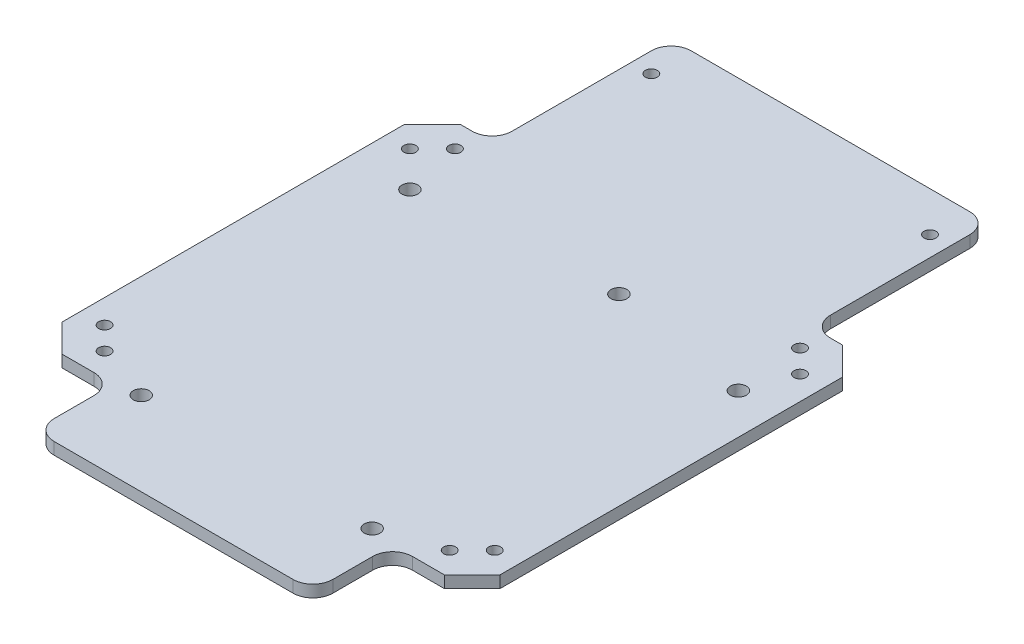
from build123d import *

# Parameters (mm, degrees)
SKETCH_1_R          = 1.5
EXTRUDE_1_DEPTH     = 3
CHAMFER_1_SIZE      = 7
FILLET_1_R          = 5
SKETCH_2_W          = 70
SKETCH_2_H          = 20
EXTRUDE_2_DEPTH     = 3
SKETCH_3_R          = 2
CUT_EXTRUDE_1_DEPTH = 3
FILLET_2_R          = 5


with BuildPart() as part:
    # 草图1 → 凸台-拉伸1 (new body)
    with BuildSketch(Plane(origin=(0, 0, 0), x_dir=(1, 0, 0), z_dir=(0, 1, 0))):
        Polygon((-55, 50), (-55, -50), (55, -50), (55, 50), (40, 50), (40, 95), (-40, 95), (-40, 50), align=None)
        with Locations(Location((-43.343145751, -44, 0), (0, 0, 270))):
            Circle(SKETCH_1_R, mode=Mode.SUBTRACT)
        with Locations(Location((-49, -38.343145751, 0), (0, 0, 270))):
            Circle(SKETCH_1_R, mode=Mode.SUBTRACT)
        with Locations(Location((43.343145751, -44, 0), (0, 0, 270))):
            Circle(SKETCH_1_R, mode=Mode.SUBTRACT)
        with Locations(Location((49, -38.343145751, 0), (0, 0, 270))):
            Circle(SKETCH_1_R, mode=Mode.SUBTRACT)
        with Locations(Location((-49, 38.343145751, 0), (0, 0, 270))):
            Circle(SKETCH_1_R, mode=Mode.SUBTRACT)
        with Locations(Location((-43.343145751, 44, 0), (0, 0, 270))):
            Circle(SKETCH_1_R, mode=Mode.SUBTRACT)
        with Locations(Location((49, 38.343145751, 0), (0, 0, 270))):
            Circle(SKETCH_1_R, mode=Mode.SUBTRACT)
        with Locations(Location((43.343145751, 44, 0), (0, 0, 270))):
            Circle(SKETCH_1_R, mode=Mode.SUBTRACT)
        with Locations(Location((35, 85, 0), (0, 0, 270))):
            Circle(SKETCH_1_R, mode=Mode.SUBTRACT)
        with Locations(Location((-35, 85, 0), (0, 0, 270))):
            Circle(SKETCH_1_R, mode=Mode.SUBTRACT)
    extrude(amount=EXTRUDE_1_DEPTH)

    # 倒角1
    chamfer_1_edges = [part.edges().sort_by_distance(p)[0] for p in [
        (-55, 1.5, 50),
        (-55, 1.5, -50),
        (55, 1.5, -50),
        (55, 1.5, 50),
    ]]
    chamfer(chamfer_1_edges, length=CHAMFER_1_SIZE)

    # 圆角1
    fillet_1_edges = [part.edges().sort_by_distance(p)[0] for p in [
        (-40, 1.5, -50),
        (-40, 1.5, -95),
        (40, 1.5, -95),
        (40, 1.5, -50),
    ]]
    fillet(fillet_1_edges, radius=FILLET_1_R)

    # 草图2 → 凸台-拉伸2 (add)
    with BuildSketch(Plane(origin=(0, 3, 0), x_dir=(1, 0, 0), z_dir=(0, 1, 0))):
        with Locations((0, -60)):
            Rectangle(SKETCH_2_W, SKETCH_2_H)
    extrude(amount=-EXTRUDE_2_DEPTH)

    # 草图3 → 切除-拉伸1 (cut)
    with BuildSketch(Plane(origin=(0, 3, 0), x_dir=(1, 0, 0), z_dir=(0, 1, 0))):
        with Locations(Location((-40.14, 29.5, 0), (0, 0, 270))):
            Circle(SKETCH_3_R)
        with Locations(Location((44.86, 27, 0), (0, 0, 270))):
            Circle(SKETCH_3_R)
        with Locations(Location((-29.14, -49, 0), (0, 0, 270))):
            Circle(SKETCH_3_R)
        with Locations(Location((28.86, -49, 0), (0, 0, 270))):
            Circle(SKETCH_3_R)
        with Locations(Location((8.86, 33, 0), (0, 0, 270))):
            Circle(SKETCH_3_R)
    extrude(amount=-CUT_EXTRUDE_1_DEPTH, mode=Mode.SUBTRACT)

    # 圆角2
    fillet_2_edges = [part.edges().sort_by_distance(p)[0] for p in [
        (-35, 1.5, 70),
        (-35, 1.5, 50),
        (35, 1.5, 50),
        (35, 1.5, 70),
    ]]
    fillet(fillet_2_edges, radius=FILLET_2_R)


solid = part.part
